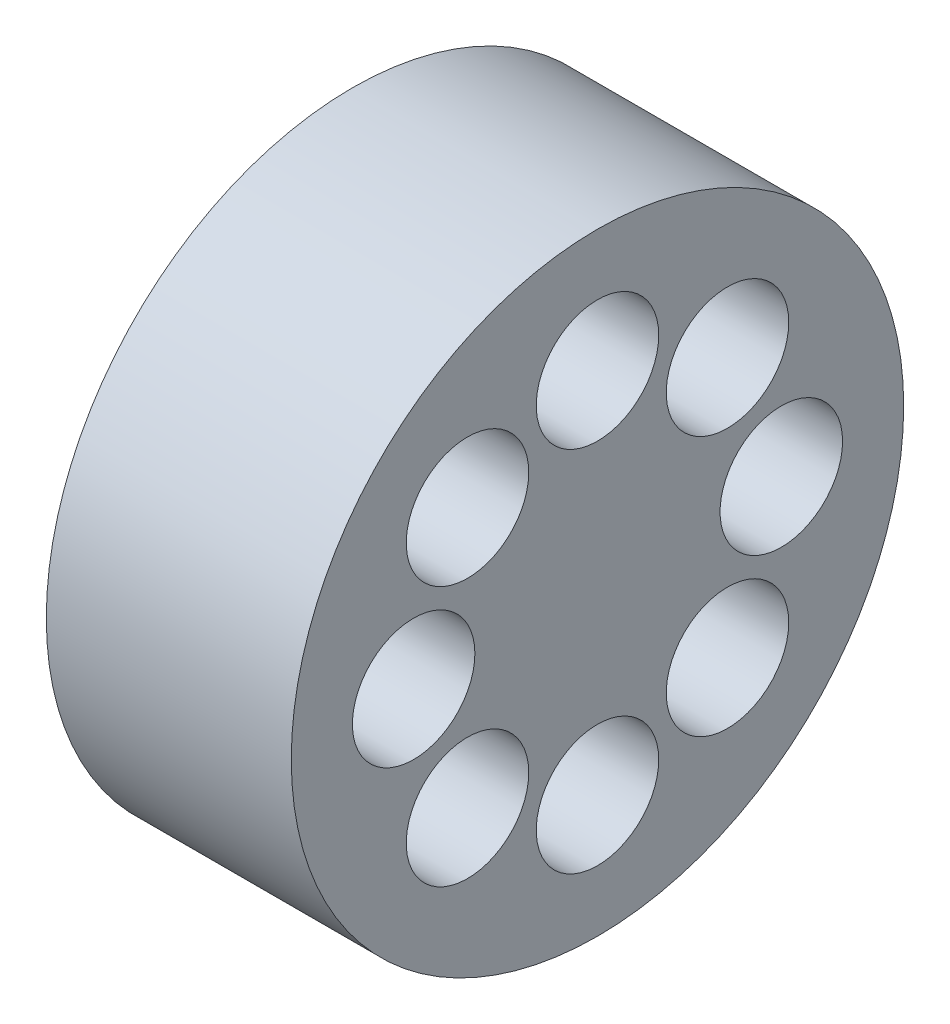
from build123d import *

# Parameters (mm, degrees)
SKETCH1_R           = 50
SKETCH1_R_2         = 10
BOSS_EXTRUDE1_DEPTH = 40


with BuildPart() as part:
    # Sketch1 → Boss-Extrude1 (new body)
    with BuildSketch(Plane(origin=(0, 0, 0), x_dir=(0, 0, -1), z_dir=(1, 0, 0))):
        Circle(SKETCH1_R)
        with Locations((30.019042005, 0)):
            Circle(SKETCH1_R_2, mode=Mode.SUBTRACT)
        with Locations((21.226668166, -21.226668166)):
            Circle(SKETCH1_R_2, mode=Mode.SUBTRACT)
        with Locations((0, -30.019042005)):
            Circle(SKETCH1_R_2, mode=Mode.SUBTRACT)
        with Locations((-21.226668166, -21.226668166)):
            Circle(SKETCH1_R_2, mode=Mode.SUBTRACT)
        with Locations((-30.019042005, 0)):
            Circle(SKETCH1_R_2, mode=Mode.SUBTRACT)
        with Locations((-21.226668166, 21.226668166)):
            Circle(SKETCH1_R_2, mode=Mode.SUBTRACT)
        with Locations((0, 30.019042005)):
            Circle(SKETCH1_R_2, mode=Mode.SUBTRACT)
        with Locations((21.226668166, 21.226668166)):
            Circle(SKETCH1_R_2, mode=Mode.SUBTRACT)
    extrude(amount=BOSS_EXTRUDE1_DEPTH)


solid = part.part
